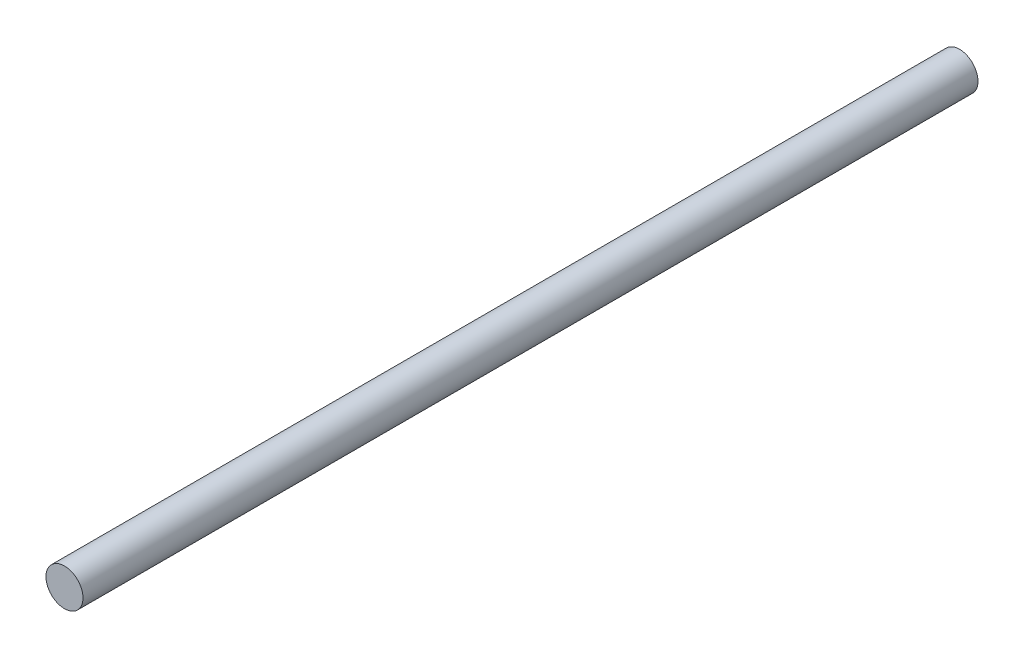
from build123d import *

# Parameters (mm, degrees)
SKETCH1_R           = 6
BOSS_EXTRUDE1_DEPTH = 290


with BuildPart() as part:
    # Sketch1 → Boss-Extrude1 (new body)
    with BuildSketch(Plane.XY):
        Circle(SKETCH1_R)
    extrude(amount=BOSS_EXTRUDE1_DEPTH)


solid = part.part
